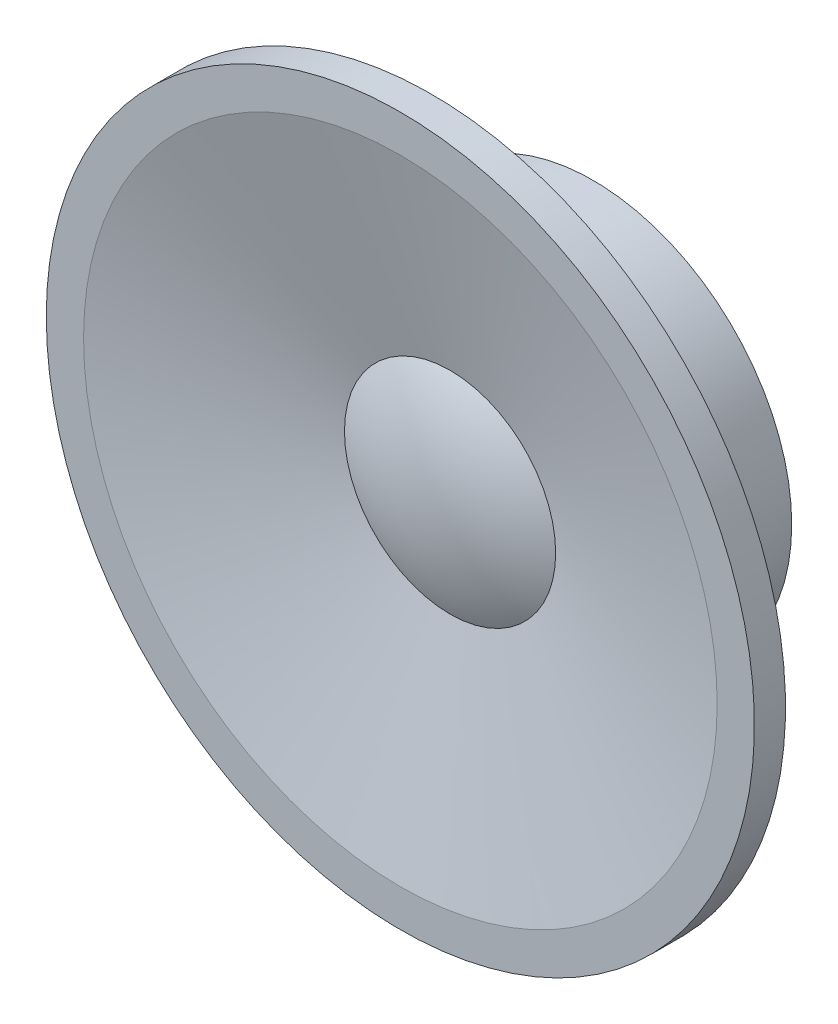
from build123d import *


with BuildPart() as part:
    # Sketch2 → Revolve1 (revolve)
    with BuildSketch(Plane(origin=(0, 0, 0), x_dir=(1, 0, 0), z_dir=(0, 1, 0)), mode=Mode.PRIVATE) as revolve1_sk:
        with BuildLine():
            Line((25.5, 0), (28.5, 0))
            Line((28.5, 0), (28.5, 2.5))
            Line((28.5, 2.5), (26.5, 2.5))
            Line((26.5, 2.5), (16, 7.5))
            Line((16, 7.5), (16, 15.5))
            Line((16, 15.5), (14, 15.5))
            Line((14, 15.5), (14, 16.5))
            Line((14, 16.5), (0, 16.5))
            Line((0, 16.5), (0, 2))
            ThreePointArc((0, 2), (4.366062299, 2.506735229), (8.5, 4))
            Line((8.5, 4), (25.5, 0))
        make_face()
    revolve(revolve1_sk.sketch.rotate(Axis((0, 0, -16.5), (0, 0, 1)), 180), axis=Axis((0, 0, -16.5), (0, 0, 1)))


solid = part.part
